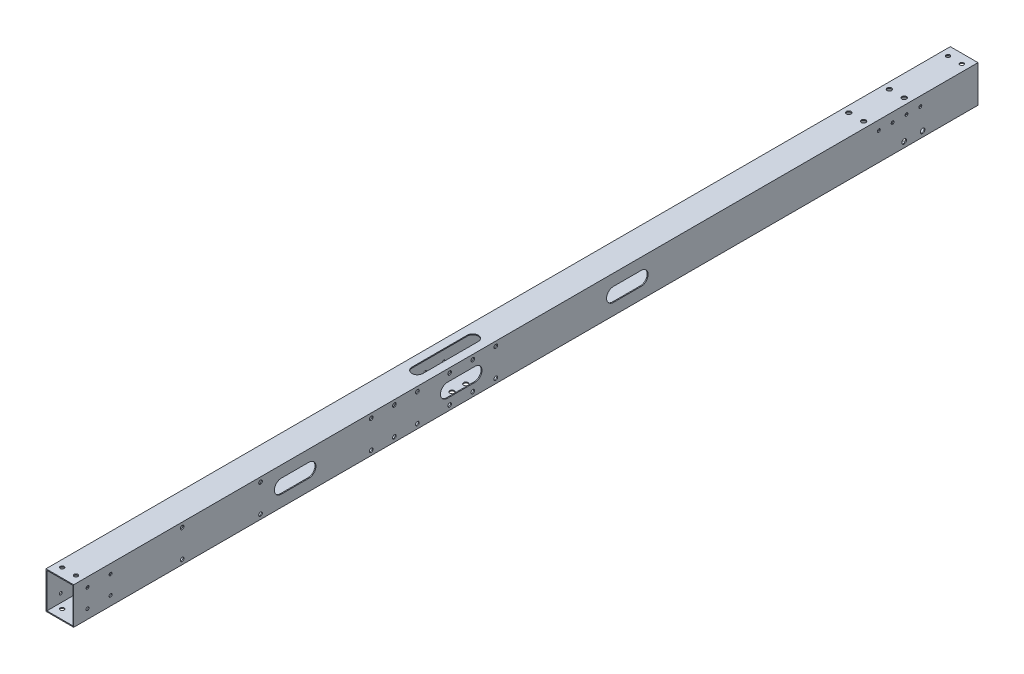
from build123d import *

# Parameters (mm, degrees)
SKETCH_1_W             = 30
SKETCH_1_H             = 40
SKETCH_1_W_2           = 28
SKETCH_1_H_2           = 38
EXTRUDE_1_DEPTH        = 940
SKETCH_5_R             = 2.5
CUT_EXTRUDE_3_DEPTH    = 941.97024395
CUT_EXTRUDE_4_DEPTH    = 1
SKETCH_7_R             = 1.5
CUT_EXTRUDE_5_DEPTH    = 1
SKETCH_17_W            = 30
SKETCH_17_H            = 40
SKETCH_17_W_2          = 28
SKETCH_17_H_2          = 38
EXTRUDE_2_DEPTH        = 20
SKETCH_18_W            = 30
SKETCH_18_H            = 40
SKETCH_18_W_2          = 28
SKETCH_18_H_2          = 38
EXTRUDE_3_DEPTH        = 20
SKETCH_19_R            = 2.1
CUT_EXTRUDE_16_DEPTH   = 961.950050731
SKETCH_20_R            = 1.6
CUT_EXTRUDE_17_DEPTH   = 961.67684473
SKETCH_21_R            = 2.5
SKETCH_21_R_2          = 1.6
CUT_EXTRUDE_18_DEPTH   = 961.67684473
SKETCH_23_R            = 2.5
CUT_EXTRUDE_19_DEPTH   = 961.950050731
SKETCH_24_R            = 4.5
CUT_EXTRUDE_20_DEPTH   = 10
SKETCH_26_R            = 2
CUT_EXTRUDE_22_DEPTH   = 961.67684473
CUT_EXTRUDE_28_DEPTH   = 10
PATTERN_LINEAR_4_COUNT = 2
PATTERN_LINEAR_4_PITCH = 255
PATTERN_LINEAR_8_COUNT = 2
PATTERN_LINEAR_8_PITCH = 205
PATTERN_LINEAR_9_COUNT = 2
PATTERN_LINEAR_9_PITCH = 230


with BuildPart() as part:
    # 草图1 → 凸台-拉伸1 (new body)
    with BuildSketch(Plane.XY):
        Rectangle(SKETCH_1_W, SKETCH_1_H)
        Rectangle(SKETCH_1_W_2, SKETCH_1_H_2, mode=Mode.SUBTRACT)
    extrude(amount=EXTRUDE_1_DEPTH)

    # 草图5 → 切除-拉伸3 (cut, through all)
    with BuildSketch(Plane.XZ.offset(20)):
        with Locations((-8, 53)):
            Circle(SKETCH_5_R)
        with Locations((8, 53)):
            Circle(SKETCH_5_R)
        with Locations((-8, 97)):
            Circle(SKETCH_5_R)
        with Locations((8, 97)):
            Circle(SKETCH_5_R)
    extrude(amount=-CUT_EXTRUDE_3_DEPTH, mode=Mode.SUBTRACT)

    # 草图6 → 切除-拉伸4 (cut)
    with BuildSketch(Plane(origin=(15, 0, 0), x_dir=(0, 0, -1), z_dir=(1, 0, 0))):
        with BuildLine():
            Line((-345, -7.5), (-375, -7.5))
            ThreePointArc((-375, -7.5), (-382.5, 0), (-375, 7.5))
            Line((-375, 7.5), (-345, 7.5))
            ThreePointArc((-345, 7.5), (-337.5, 0), (-345, -7.5))
        make_face()
        with BuildLine():
            Line((-525, -7.5), (-555, -7.5))
            ThreePointArc((-555, -7.5), (-562.5, 0), (-555, 7.5))
            Line((-555, 7.5), (-525, 7.5))
            ThreePointArc((-525, 7.5), (-517.5, 0), (-525, -7.5))
        make_face()
        with BuildLine():
            Line((-705, -7.5), (-735, -7.5))
            ThreePointArc((-735, -7.5), (-742.5, 0), (-735, 7.5))
            Line((-735, 7.5), (-705, 7.5))
            ThreePointArc((-705, 7.5), (-697.5, 0), (-705, -7.5))
        make_face()
    extrude(amount=-CUT_EXTRUDE_4_DEPTH, mode=Mode.SUBTRACT)

    # 草图7 → 切除-拉伸5 (cut)
    with BuildSketch(Plane.ZY.offset(15)):
        with Locations((350, 0)):
            Circle(SKETCH_7_R)
        with Locations((370, 0)):
            Circle(SKETCH_7_R)
        with Locations((530, 0)):
            Circle(SKETCH_7_R)
        with Locations((550, 0)):
            Circle(SKETCH_7_R)
        with Locations((710, 0)):
            Circle(SKETCH_7_R)
        with Locations((730, 0)):
            Circle(SKETCH_7_R)
    extrude(amount=-CUT_EXTRUDE_5_DEPTH, mode=Mode.SUBTRACT)

    # 草图17 → 凸台-拉伸2 (add)
    with BuildSketch(Plane.XY.offset(940)):
        Rectangle(SKETCH_17_W, SKETCH_17_H)
        Rectangle(SKETCH_17_W_2, SKETCH_17_H_2, mode=Mode.SUBTRACT)
    extrude(amount=EXTRUDE_2_DEPTH)

    # 草图18 → 凸台-拉伸3 (add)
    with BuildSketch(Plane(origin=(0, 0, 0), x_dir=(-1, 0, 0), z_dir=(0, 0, -1))):
        Rectangle(SKETCH_18_W, SKETCH_18_H)
        Rectangle(SKETCH_18_W_2, SKETCH_18_H_2, mode=Mode.SUBTRACT)
    extrude(amount=EXTRUDE_3_DEPTH)

    # 草图19 → 切除-拉伸16 (cut, through all)
    with BuildSketch(Plane(origin=(0, 20, 0), x_dir=(1, 0, 0), z_dir=(0, 1, 0))):
        with Locations((-7.5, -950)):
            Circle(SKETCH_19_R)
        with Locations((7.5, -950)):
            Circle(SKETCH_19_R)
        with Locations((-7.5, 10)):
            Circle(SKETCH_19_R)
        with Locations((7.5, 10)):
            Circle(SKETCH_19_R)
    extrude(amount=-CUT_EXTRUDE_16_DEPTH, mode=Mode.SUBTRACT)

    # 草图20 → 切除-拉伸17 (cut, through all)
    with BuildSketch(Plane(origin=(15, 0, 0), x_dir=(0, 0, -1), z_dir=(1, 0, 0))):
        with Locations((-945, 10)):
            Circle(SKETCH_20_R)
        with Locations((-920, 10)):
            Circle(SKETCH_20_R)
        with Locations((-920, -10)):
            Circle(SKETCH_20_R)
        with Locations((-945, -10)):
            Circle(SKETCH_20_R)
    extrude(amount=-CUT_EXTRUDE_17_DEPTH, mode=Mode.SUBTRACT)

    # 草图21 → 切除-拉伸18 (cut, through all)
    with BuildSketch(Plane(origin=(15, 0, 0), x_dir=(0, 0, -1), z_dir=(1, 0, 0))):
        with Locations((-40, -14)):
            Circle(SKETCH_21_R)
        with Locations((-60, -14)):
            Circle(SKETCH_21_R)
        with Locations((-42.5, 10)):
            Circle(SKETCH_21_R_2)
        with Locations((-57.5, 10)):
            Circle(SKETCH_21_R_2)
        with Locations((-72.5, 10)):
            Circle(SKETCH_21_R_2)
        with Locations((-87.5, 10)):
            Circle(SKETCH_21_R_2)
    extrude(amount=-CUT_EXTRUDE_18_DEPTH, mode=Mode.SUBTRACT)

    # 草图23 → 切除-拉伸19 (cut, through all)
    with BuildSketch(Plane(origin=(0, 20, 0), x_dir=(1, 0, 0), z_dir=(0, 1, 0))):
        with Locations((0, -520)):
            Circle(SKETCH_23_R)
        with Locations((0, -535)):
            Circle(SKETCH_23_R)
        with Locations((0, -550)):
            Circle(SKETCH_23_R)
        with Locations((0, -565)):
            Circle(SKETCH_23_R)
    extrude(amount=-CUT_EXTRUDE_19_DEPTH, mode=Mode.SUBTRACT)

    # 草图24 → 切除-拉伸20 (cut)
    with BuildSketch(Plane(origin=(0, 20, 0), x_dir=(1, 0, 0), z_dir=(0, 1, 0))):
        with Locations((0, -520)):
            Circle(SKETCH_24_R)
        with Locations((0, -535)):
            Circle(SKETCH_24_R)
        with Locations((0, -550)):
            Circle(SKETCH_24_R)
        with Locations((0, -565)):
            Circle(SKETCH_24_R)
    extrude(amount=-CUT_EXTRUDE_20_DEPTH, mode=Mode.SUBTRACT)

    # 草图26 → 切除-拉伸22 (cut, through all)
    with BuildSketch(Plane(origin=(15, 0, 0), x_dir=(0, 0, -1), z_dir=(1, 0, 0))):
        with Locations((-842.5, 15)):
            Circle(SKETCH_26_R)
        with Locations((-842.5, -15)):
            Circle(SKETCH_26_R)
        with Locations((-757.5, -15)):
            Circle(SKETCH_26_R)
        with Locations((-757.5, 15)):
            Circle(SKETCH_26_R)
    cut_extrude_22 = extrude(amount=-CUT_EXTRUDE_22_DEPTH, mode=Mode.SUBTRACT)

    # 草图33 → 切除-拉伸28 (cut)
    with BuildSketch(Plane(origin=(0, 20, 0), x_dir=(1, 0, 0), z_dir=(0, 1, 0))):
        with BuildLine():
            Line((6, -512.5), (6, -572.5))
            ThreePointArc((6, -572.5), (0, -578.5), (-6, -572.5))
            Line((-6, -572.5), (-6, -512.5))
            ThreePointArc((-6, -512.5), (0, -506.5), (6, -512.5))
        make_face()
    extrude(amount=-CUT_EXTRUDE_28_DEPTH, mode=Mode.SUBTRACT)

    # 阵列(线性)4: 切除-拉伸22 ×2
    with Locations(*[(0, 0, -i * PATTERN_LINEAR_4_PITCH) for i in range(1, PATTERN_LINEAR_4_COUNT)]):
        add(cut_extrude_22, mode=Mode.SUBTRACT)

    # 阵列(线性)8: 切除-拉伸22 ×2
    with Locations(*[(0, 0, -i * PATTERN_LINEAR_8_PITCH) for i in range(1, PATTERN_LINEAR_8_COUNT)]):
        add(cut_extrude_22, mode=Mode.SUBTRACT)

    # 阵列(线性)9: 切除-拉伸22 ×2
    with Locations(*[(0, 0, -i * PATTERN_LINEAR_9_PITCH) for i in range(1, PATTERN_LINEAR_9_COUNT)]):
        add(cut_extrude_22, mode=Mode.SUBTRACT)


solid = part.part
